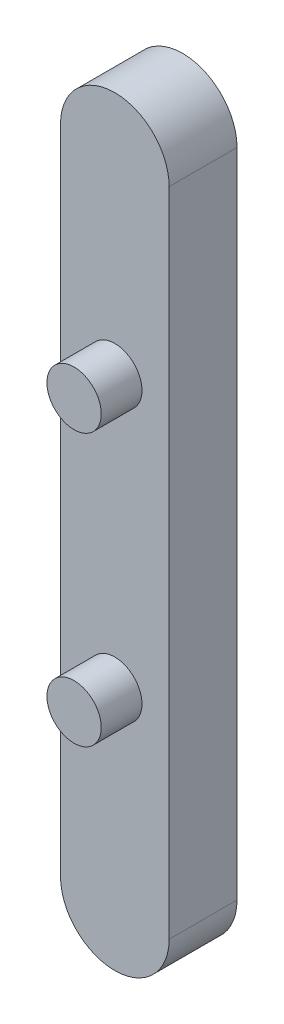
from build123d import *

# Parameters (mm, degrees)
BOSS_EXTRU_1_DEPTH = 2.5
ESQUISSE2_R        = 1
BOSS_EXTRU_2_DEPTH = 1.5


with BuildPart() as part:
    # Esquisse1 → Boss.-Extru.1 (new body)
    with BuildSketch(Plane.XY):
        with BuildLine():
            Line((-2, 0), (-2, 24))
            ThreePointArc((-2, 24), (0, 26), (2, 24))
            Line((2, 24), (2, 0))
            ThreePointArc((2, 0), (0, -2), (-2, 0))
        make_face()
    extrude(amount=BOSS_EXTRU_1_DEPTH)

    # Esquisse2 → Boss.-Extru.2 (add)
    with BuildSketch(Plane.XY.offset(2.5)):
        with Locations((0, 17)):
            Circle(ESQUISSE2_R)
        with Locations((0, 7)):
            Circle(ESQUISSE2_R)
    extrude(amount=BOSS_EXTRU_2_DEPTH)


solid = part.part
